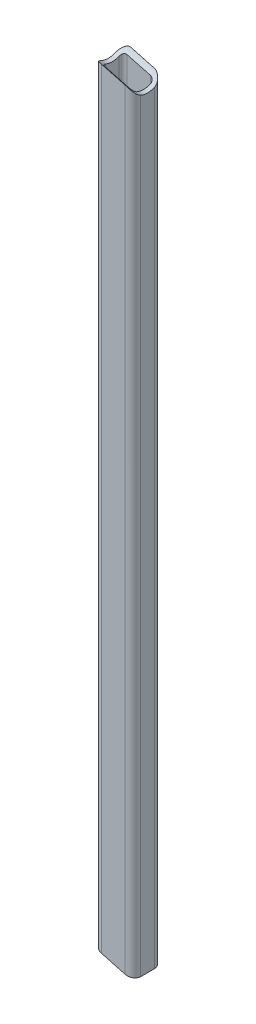
from build123d import *

# Parameters (mm, degrees)
EXTRUDE_1_DEPTH          = 199
EXTRUDE_1_DEPTH_BACK     = 200
CUT_EXTRUDE_1_DEPTH      = 10
CUT_EXTRUDE_1_DEPTH_BACK = 30
SKETCH_3_R               = 9


with BuildPart() as part:
    # Эскиз1 → Вытянуть-Тонкостенный1 (new, two sides: drawn at the far end of the back side and taken through both)
    with BuildSketch(Plane(origin=(0, 0, 0), x_dir=(1, 0, 0), z_dir=(0, 1, 0)).offset(-EXTRUDE_1_DEPTH_BACK)):
        with BuildLine():
            Line((-6, 7.5), (6, 7.5))
            ThreePointArc((6, 7.5), (8.828427125, 6.328427125), (10, 3.5))
            Line((10, 3.5), (10, -3.5))
            ThreePointArc((10, -3.5), (8.828427125, -6.328427125), (6, -7.5))
            Line((6, -7.5), (-6, -7.5))
            ThreePointArc((-6, -7.5), (-8.828427125, -6.328427125), (-10, -3.5))
            Line((-10, -3.5), (-10, 3.5))
            ThreePointArc((-10, 3.5), (-8.828427125, 6.328427125), (-6, 7.5))
        make_face()
        with BuildLine():
            Line((-6, 5.5), (6, 5.5))
            ThreePointArc((6, 5.5), (7.414213562, 4.914213562), (8, 3.5))
            Line((8, 3.5), (8, -3.5))
            ThreePointArc((8, -3.5), (7.414213562, -4.914213562), (6, -5.5))
            Line((6, -5.5), (-6, -5.5))
            ThreePointArc((-6, -5.5), (-7.414213562, -4.914213562), (-8, -3.5))
            Line((-8, -3.5), (-8, 3.5))
            ThreePointArc((-8, 3.5), (-7.414213562, 4.914213562), (-6, 5.5))
        make_face(mode=Mode.SUBTRACT)
    extrude(amount=EXTRUDE_1_DEPTH + EXTRUDE_1_DEPTH_BACK)

    # Surface Cut 1
    split(bisect_by=Plane(origin=(49.080127019, 183.169527677, 0), x_dir=(0, 0, 1), z_dir=(0.25881904510252135, 0.9659258262890681, 0)), keep=Keep.BOTTOM)

    # Эскиз3 → Вырез-Вытянуть1 (cut, two sides: drawn at the far end of the back side and taken through both)
    with BuildSketch(Plane(origin=(-59.080127019, 15.830472323, 0), x_dir=(0, 0, 1), z_dir=(-0.9659258262890681, 0.25881904510252135, 0)).offset(-CUT_EXTRUDE_1_DEPTH_BACK)):
        with Locations((0, 194.63104898)):
            Circle(SKETCH_3_R)
    extrude(amount=CUT_EXTRUDE_1_DEPTH + CUT_EXTRUDE_1_DEPTH_BACK, mode=Mode.SUBTRACT)

    # Surface Cut 2
    split(bisect_by=Plane(origin=(-49.330127019, -184.102540378, 0), x_dir=(0, 0, -1), z_dir=(0.25881904510252135, 0.9659258262890681, 0)), keep=Keep.TOP)


solid = part.part
